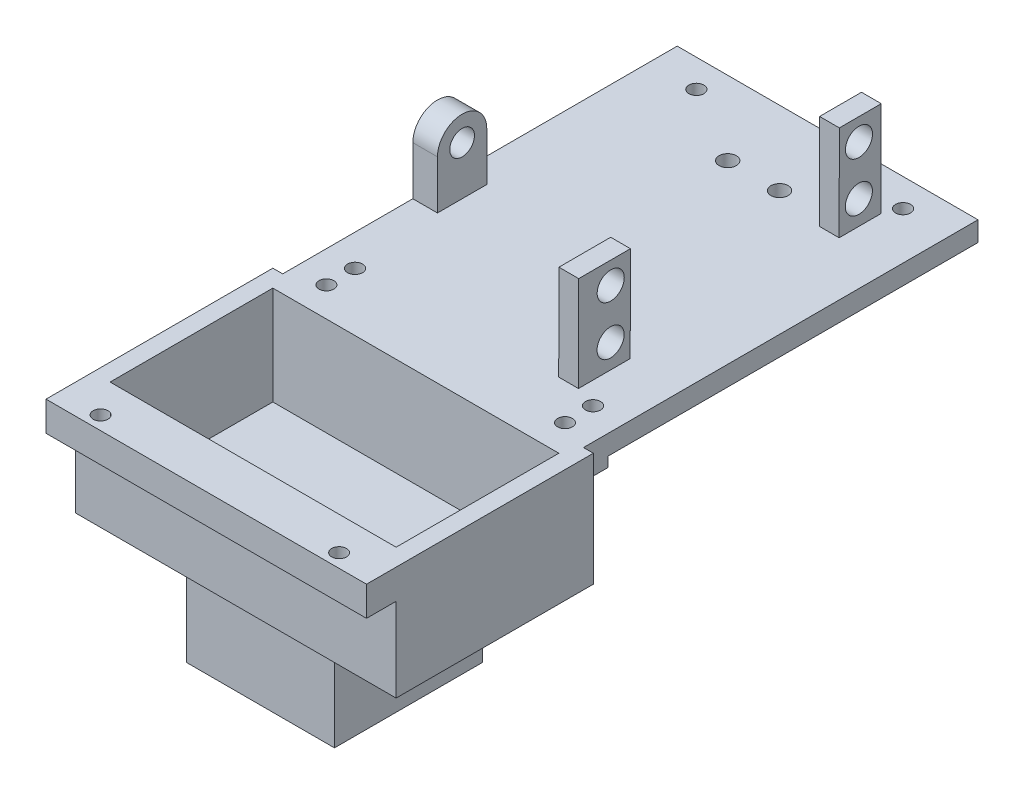
from build123d import *

# Parameters (mm, degrees)
SKETCH_1_W               = 60.99726579
SKETCH_1_H               = 80
EXTRUDE_1_DEPTH          = 1
SKETCH_2_R               = 1.524
CUT_EXTRUDE_1_DEPTH      = 1
SKETCH_3_W               = 1
SKETCH_3_H               = 21.992162459
EXTRUDE_2_DEPTH          = 22
SKETCH_7_W               = 7.5
SKETCH_7_H               = 19.330567091
SKETCH_7_R               = 2.75
EXTRUDE_3_DEPTH          = 3
SKETCH_7_H_2             = 19.330671724
EXTRUDE_3_2_DEPTH        = 3
SKETCH_8_R               = 2.5
EXTRUDE_4_DEPTH          = 5
SKETCH_12_W              = 2
SKETCH_12_H              = 21.992162459
EXTRUDE_5_DEPTH          = 22
CUT_EXTRUDE_3_DEPTH      = 72.341536493
CUT_EXTRUDE_3_DEPTH_BACK = 15
SKETCH_9_R               = 1.75
SKETCH_14_W              = 17.99726579
SKETCH_14_H              = 10.99608123
EXTRUDE_6_DEPTH          = 3
SKETCH_15_R              = 1.75
CUT_EXTRUDE_4_DEPTH      = 67.029179397
SKETCH_18_W              = 125.682596232
SKETCH_18_H              = 131.027051286
CUT_EXTRUDE_6_DEPTH      = 66.55792676
EXTRUDE_START            = 3
SKETCH_19_W              = 60.99726579
SKETCH_19_H              = 80
SKETCH_19_R              = 1.524
SKETCH_19_R_2            = 1.75
EXTRUDE_7_DEPTH          = 3
SKETCH_20_W              = 60.99726579
SKETCH_20_H              = 40
EXTRUDE_8_DEPTH          = 23
SKETCH_21_W              = 58
SKETCH_21_H              = 33
CUT_EXTRUDE_7_DEPTH      = 20
SKETCH_26_W              = 30
SKETCH_26_H              = 30
EXTRUDE_9_DEPTH          = 20
EXTRUDE_10_DEPTH         = 3
SKETCH_28_W              = 10.5
SKETCH_28_H              = 19.330671724
SKETCH_28_R              = 2.75
EXTRUDE_11_DEPTH         = 1
EXTRUDE_12_DEPTH         = 1
SKETCH_30_W              = 8.5
SKETCH_30_H              = 19.330567091
SKETCH_30_R              = 2.75
EXTRUDE_13_DEPTH         = 1
SKETCH_31_W              = 60.99726579
SKETCH_31_H              = 5
SKETCH_31_R              = 1.5
EXTRUDE_14_DEPTH         = 2
SKETCH_33_R              = 1.5
CUT_EXTRUDE_8_DEPTH      = 110.173112919
SKETCH_35_W              = 40
SKETCH_35_H              = 23
EXTRUDE_15_DEPTH         = 2
SKETCH_36_W              = 40
SKETCH_36_H              = 23
EXTRUDE_16_DEPTH         = 2
SKETCH_38_W              = 64.99726579
SKETCH_38_H              = 6
EXTRUDE_17_DEPTH         = 6
SKETCH_39_R              = 1.5
CUT_EXTRUDE_13_DEPTH     = 6


with BuildPart() as part:
    # 스케치1 → 보스-돌출1 (new body)
    with BuildSketch(Plane(origin=(0, 0, 0), x_dir=(1, 0, 0), z_dir=(0, 1, 0))):
        with Locations((0.001367105, -13.699085291)):
            Rectangle(SKETCH_1_W, SKETCH_1_H)
    extrude(amount=EXTRUDE_1_DEPTH)

    # 스케치2 → 컷-돌출1 (cut)
    with BuildSketch(Plane.XZ):
        with Locations(Location((-24.13, 45.395, 0), (0, 0, 270))):
            Circle(SKETCH_2_R)
        with Locations(Location((24.13, 45.395, 0), (0, 0, 270))):
            Circle(SKETCH_2_R)
        with Locations(Location((-20.955, -20.645, 0), (0, 0, 270))):
            Circle(SKETCH_2_R)
        with Locations(Location((20.955, -20.645, 0), (0, 0, 270))):
            Circle(SKETCH_2_R)
    extrude(amount=-CUT_EXTRUDE_1_DEPTH, mode=Mode.SUBTRACT)

    # 스케치3 → 보스-돌출2 (add)
    with BuildSketch(Plane.XZ):
        with Locations((-11.49726579, -15.30483348)):
            Rectangle(SKETCH_3_W, SKETCH_3_H)
        with Locations((11.5, -15.30483348)):
            Rectangle(SKETCH_3_W, SKETCH_3_H)
    extrude(amount=EXTRUDE_2_DEPTH)

    # 스케치8 → 보스-돌출4 (add)
    with BuildSketch(Plane.ZY.offset(30.49726579)):
        with BuildLine():
            Line((17.314820169, 10.855722027), (17.314820169, 1))
            Line((17.314820169, 1), (27.314820169, 1))
            Line((27.314820169, 1), (27.314820169, 10.855722027))
            ThreePointArc((27.314820169, 10.855722027), (22.314820169, 15.855722027), (17.314820169, 10.855722027))
        make_face()
        with Locations((22.314820169, 10.855722027)):
            Circle(SKETCH_8_R, mode=Mode.SUBTRACT)
    extrude(amount=-EXTRUDE_4_DEPTH)

    # 스케치12 → 보스-돌출5 (add)
    with BuildSketch(Plane.XZ):
        with Locations((-9.99726579, -15.30483348)):
            Rectangle(SKETCH_12_W, SKETCH_12_H)
        with Locations((10, -15.30483348)):
            Rectangle(SKETCH_12_W, SKETCH_12_H)
    extrude(amount=EXTRUDE_5_DEPTH)

    # 스케치9 → 컷-돌출3 (cut, two sides: drawn at the far end of the back side and taken through both)
    with BuildSketch(Plane.ZY.offset(-11).offset(-CUT_EXTRUDE_3_DEPTH_BACK)):
        with Locations(Location((-22.606276953, -2.5, 0), (0, 0, 180))):
            Circle(SKETCH_9_R)
        with Locations(Location((-22.606276953, -19.5, 0), (0, 0, 180))):
            Circle(SKETCH_9_R)
    extrude(amount=CUT_EXTRUDE_3_DEPTH + CUT_EXTRUDE_3_DEPTH_BACK, mode=Mode.SUBTRACT)

    # 스케치14 → 보스-돌출6 (add)
    with BuildSketch(Plane.XZ):
        with Locations((0.001367105, -9.806792865)):
            Rectangle(SKETCH_14_W, SKETCH_14_H)
    extrude(amount=EXTRUDE_6_DEPTH)

    # 스케치15 → 컷-돌출4 (cut, through all)
    with BuildSketch(Plane.XZ.offset(3)):
        with Locations(Location((-5.258745872, -11.300890987, 0), (0, 0, 270))):
            Circle(SKETCH_15_R)
        with Locations(Location((5.258745872, -11.300890987, 0), (0, 0, 270))):
            Circle(SKETCH_15_R)
    extrude(amount=-CUT_EXTRUDE_4_DEPTH, mode=Mode.SUBTRACT)

    # 스케치18 → 컷-돌출6 (cut, through all)
    with BuildSketch(Plane.XZ):
        with Locations((10.227533259, 5.024212254)):
            Rectangle(SKETCH_18_W, SKETCH_18_H)
    extrude(amount=CUT_EXTRUDE_6_DEPTH, mode=Mode.SUBTRACT)

    # 스케치19 → 보스-돌출7 (add)
    with BuildSketch(Plane.XZ.offset(EXTRUDE_START)):
        with Locations((0.001367105, 13.699085291)):
            Rectangle(SKETCH_19_W, SKETCH_19_H)
        with Locations(Location((-24.13, 45.395, 0), (0, 0, 270))):
            Circle(SKETCH_19_R, mode=Mode.SUBTRACT)
        with Locations(Location((24.13, 45.395, 0), (0, 0, 270))):
            Circle(SKETCH_19_R, mode=Mode.SUBTRACT)
        with Locations(Location((-5.258745872, -11.300890987, 0), (0, 0, 270))):
            Circle(SKETCH_19_R_2, mode=Mode.SUBTRACT)
        with Locations(Location((5.258745872, -11.300890987, 0), (0, 0, 270))):
            Circle(SKETCH_19_R_2, mode=Mode.SUBTRACT)
        with Locations(Location((-20.955, -20.645, 0), (0, 0, 270))):
            Circle(SKETCH_19_R, mode=Mode.SUBTRACT)
        with Locations(Location((20.955, -20.645, 0), (0, 0, 270))):
            Circle(SKETCH_19_R, mode=Mode.SUBTRACT)
    extrude(amount=-EXTRUDE_7_DEPTH)

    # 스케치20 → 보스-돌출8 (add)
    with BuildSketch(Plane(origin=(0, 1, 0), x_dir=(1, 0, 0), z_dir=(0, 1, 0))):
        with Locations((0.001367105, -73.699085291)):
            Rectangle(SKETCH_20_W, SKETCH_20_H)
    extrude(amount=-EXTRUDE_8_DEPTH)

    # 스케치21 → 컷-돌출7 (cut)
    with BuildSketch(Plane(origin=(0, 1, 0), x_dir=(1, 0, 0), z_dir=(0, 1, 0))):
        with Locations((0.001367105, -73.699085291)):
            Rectangle(SKETCH_21_W, SKETCH_21_H)
    extrude(amount=-CUT_EXTRUDE_7_DEPTH, mode=Mode.SUBTRACT)



with BuildPart() as body_2:
    # 스케치7 → 보스-돌출3 (new body)
    with BuildSketch(Plane(origin=(19.618416861, -0.051361028, -0.014963481), x_dir=(0.0007627207868309801, -1.996803493320823e-06, 0.9999997091264647), z_dir=(-0.9999962821814526, 0.002617990887417953, 0.0007627234006428938))):
        with Locations((-12.757304863, 10.745128864)):
            Rectangle(SKETCH_7_W, SKETCH_7_H)
        with Locations(Location((-12.998254061, 15.951338675, 0), (0, 0, 270))):
            Circle(SKETCH_7_R, mode=Mode.SUBTRACT)
        with Locations(Location((-12.998234093, 5.951338675, 0), (0, 0, 270))):
            Circle(SKETCH_7_R, mode=Mode.SUBTRACT)
    extrude(amount=EXTRUDE_3_DEPTH)

    # 스케치29 → 보스-돌출12 (add)
    with BuildSketch(Plane(origin=(-0.012590465, 3.2962e-05, -16.507300061), x_dir=(-0.9999997091284585, -1.523003974434168e-09, 0.0007627207868294601), z_dir=(-0.0007627207868309806, 1.996803493141394e-06, -0.9999997091264647))):
        Polygon((-19.671856873, 20.358981407), (-19.621249595, 1.02848056), (-16.621259875, 1.036334538), (-16.671867153, 20.366835384), align=None)
    extrude(amount=EXTRUDE_12_DEPTH)

    # 스케치30 → 보스-돌출13 (add)
    with BuildSketch(Plane(origin=(16.618428015, -0.043507055, -0.012675311), x_dir=(0.0007627207868311324, -1.996803493321271e-06, 0.9999997091264647), z_dir=(-0.9999962821814526, 0.0026179908874180216, 0.0007627234006430462))):
        with Locations((-13.257304863, 10.745128864)):
            Rectangle(SKETCH_30_W, SKETCH_30_H)
        with Locations(Location((-12.998254061, 15.951338675, 0), (0, 0, 270))):
            Circle(SKETCH_30_R, mode=Mode.SUBTRACT)
        with Locations(Location((-12.998234093, 5.951338675, 0), (0, 0, 270))):
            Circle(SKETCH_30_R, mode=Mode.SUBTRACT)
    extrude(amount=EXTRUDE_13_DEPTH)


with BuildPart() as body_3:
    # 스케치7 → Extrude 3 2 (new body)
    with BuildSketch(Plane(origin=(19.618416861, -0.051361028, -0.014963481), x_dir=(0.0007627207868309801, -1.996803493320823e-06, 0.9999997091264647), z_dir=(-0.9999962821814526, 0.002617990887417953, 0.0007627234006428938))):
        with Locations((37.142697347, 10.74518118)):
            Rectangle(SKETCH_7_W, SKETCH_7_H_2)
        with Locations(Location((37.383594441, 15.951439278, 0), (0, 0, 270))):
            Circle(SKETCH_7_R, mode=Mode.SUBTRACT)
        with Locations(Location((37.383614409, 5.951439278, 0), (0, 0, 270))):
            Circle(SKETCH_7_R, mode=Mode.SUBTRACT)
    extrude(amount=EXTRUDE_3_2_DEPTH)

    # 스케치27 → 보스-돌출10 (add)
    with BuildSketch(Plane(origin=(0.03118971, -8.1655e-05, 40.892685452), x_dir=(0.9999997091284585, 1.5230039745710364e-09, -0.0007627207868294599), z_dir=(0.0007627207868309804, -1.9968034933208416e-06, 0.9999997091264647))):
        Polygon((19.621249595, 1.02848056), (19.671857146, 20.359086039), (16.671867427, 20.366940016), (16.621259875, 1.036334538), align=None)
    extrude(amount=EXTRUDE_10_DEPTH)

    # 스케치28 → 보스-돌출11 (add)
    with BuildSketch(Plane(origin=(16.618428015, -0.043507055, -0.012675311), x_dir=(0.00076272078683067, -1.996803493320029e-06, 0.9999997091264647), z_dir=(-0.9999962821814526, 0.002617990887417981, 0.0007627234006425838))):
        with Locations((38.642697347, 10.74518118)):
            Rectangle(SKETCH_28_W, SKETCH_28_H)
        with Locations(Location((37.383594441, 15.951439278, 0), (0, 0, 270))):
            Circle(SKETCH_28_R, mode=Mode.SUBTRACT)
        with Locations(Location((37.383614409, 5.951439278, 0), (0, 0, 270))):
            Circle(SKETCH_28_R, mode=Mode.SUBTRACT)
    extrude(amount=EXTRUDE_11_DEPTH)


with BuildPart() as body_4:
    # 스케치24 → 회전1 (revolve)
    with BuildSketch(Plane(origin=(0, 0, 0), x_dir=(0, 0, -1), z_dir=(1, 0, 0))):
        with BuildLine():
            Line((-73.699085291, -52), (-73.699085291, -42))
            Line((-73.699085291, -42), (-63.699085291, -42))
            ThreePointArc((-63.699085291, -42), (-66.628017479, -49.071067812), (-73.699085291, -52))
        make_face()
    revolve(axis=Axis((0, -22, 73.699085291), (0, -1, 0)))


with BuildPart() as part_1:
    add(part.part)

    add(body_4.part)  # 보스-돌출9 merges body 4
    # 스케치26 → 보스-돌출9 (add)
    with BuildSketch(Plane.XZ.offset(22)):
        with Locations((0, 73.699085291)):
            Rectangle(SKETCH_26_W, SKETCH_26_H)
    extrude(amount=EXTRUDE_9_DEPTH)

    # 스케치31 → 보스-돌출14 (add)
    with BuildSketch(Plane.XZ.offset(3)):
        with Locations((0.001367105, 51.199085291)):
            Rectangle(SKETCH_31_W, SKETCH_31_H)
        with Locations(Location((-24.13, 51.199085291, 0), (0, 0, 270))):
            Circle(SKETCH_31_R, mode=Mode.SUBTRACT)
        with Locations(Location((24.250641605, 51.199085291, 0), (0, 0, 270))):
            Circle(SKETCH_31_R, mode=Mode.SUBTRACT)
    extrude(amount=EXTRUDE_14_DEPTH)

    # 스케치33 → 컷-돌출8 (cut, through all)
    with BuildSketch(Plane.XZ.offset(5)):
        with Locations(Location((24.250641605, 51.199085291, 0), (0, 0, 270))):
            Circle(SKETCH_33_R)
        with Locations(Location((-24.13, 51.199085291, 0), (0, 0, 270))):
            Circle(SKETCH_33_R)
    extrude(amount=-CUT_EXTRUDE_8_DEPTH, mode=Mode.SUBTRACT)

    # 스케치35 → 보스-돌출15 (add)
    with BuildSketch(Plane.ZY.offset(30.49726579)):
        with Locations((73.699085291, -10.5)):
            Rectangle(SKETCH_35_W, SKETCH_35_H)
    extrude(amount=EXTRUDE_15_DEPTH)

    # 스케치36 → 보스-돌출16 (add)
    with BuildSketch(Plane(origin=(30.5, 0, 0), x_dir=(0, 0, -1), z_dir=(1, 0, 0))):
        with Locations((-73.699085291, -10.5)):
            Rectangle(SKETCH_36_W, SKETCH_36_H)
    extrude(amount=EXTRUDE_16_DEPTH)

    # 스케치38 → 보스-돌출17 (add)
    with BuildSketch(Plane.XY.offset(93.699085291)):
        with Locations((0.001367105, -2)):
            Rectangle(SKETCH_38_W, SKETCH_38_H)
    extrude(amount=EXTRUDE_17_DEPTH)

    # 스케치39 → 컷-돌출13 (cut)
    with BuildSketch(Plane(origin=(0, 1, 0), x_dir=(1, 0, 0), z_dir=(0, 1, 0))):
        with Locations(Location((-24.188953697, -96.94478326, 0), (0, 0, 270))):
            Circle(SKETCH_39_R)
        with Locations(Location((24.191687908, -96.94478326, 0), (0, 0, 270))):
            Circle(SKETCH_39_R)
    extrude(amount=-CUT_EXTRUDE_13_DEPTH, mode=Mode.SUBTRACT)


solid = Compound([body_2.part, body_3.part, part_1.part])
